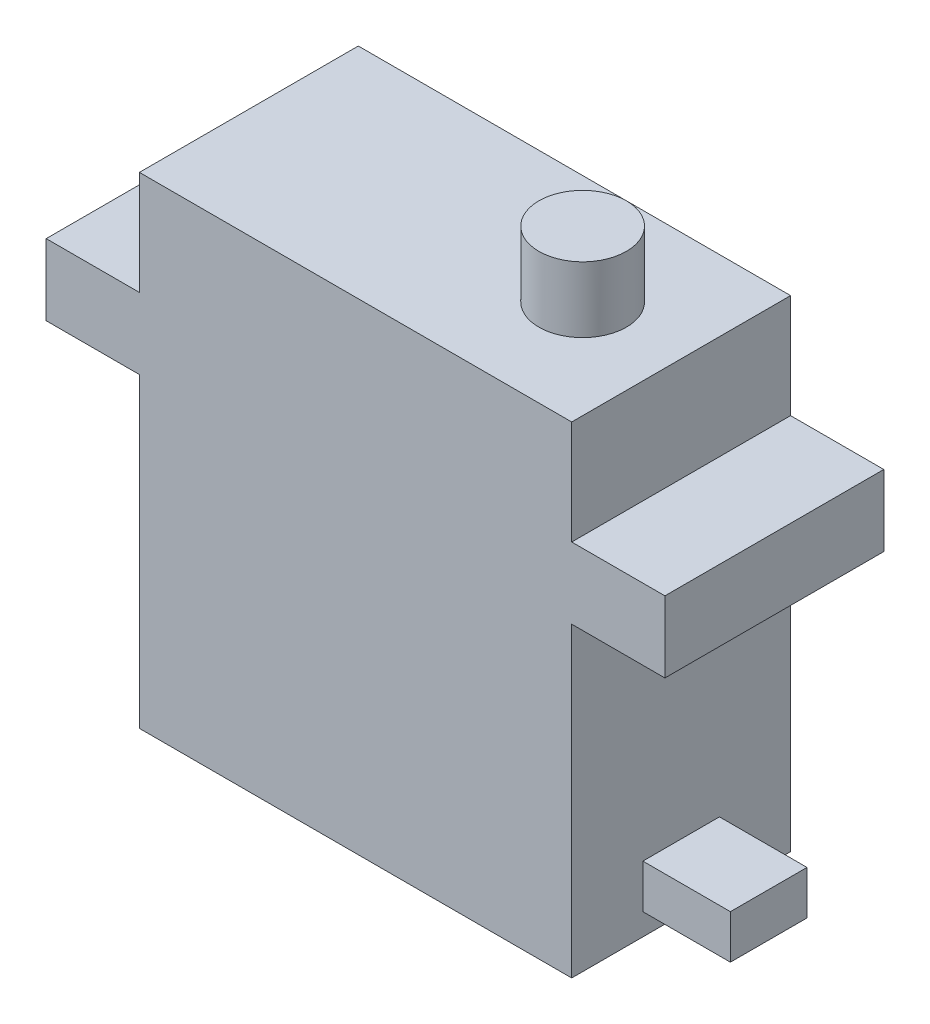
from build123d import *

# Parameters (mm, degrees)
SKETCH1_W           = 39.5
SKETCH1_H           = 20
BOSS_EXTRUDE1_DEPTH = 28
BOSS_EXTRUDE2_DEPTH = 6.5
SKETCH3_W           = 39.5
SKETCH3_H           = 20
BOSS_EXTRUDE3_DEPTH = 9.5
SKETCH4_R           = 4
BOSS_EXTRUDE4_DEPTH = 6
SKETCH5_W           = 7
SKETCH5_H           = 4
BOSS_EXTRUDE5_DEPTH = 8


with BuildPart() as part:
    # Sketch1 → Boss-Extrude1 (new body)
    with BuildSketch(Plane(origin=(0, 0, 0), x_dir=(1, 0, 0), z_dir=(0, 1, 0))):
        with Locations((-23.401244555, 9.028670505)):
            Rectangle(SKETCH1_W, SKETCH1_H)
    extrude(amount=BOSS_EXTRUDE1_DEPTH)

    # Sketch2 → Boss-Extrude2 (add)
    with BuildSketch(Plane(origin=(0, 28, 0), x_dir=(1, 0, 0), z_dir=(0, 1, 0))):
        Polygon((-43.151244555, 19.028670505), (-51.668180021, 19.028670505), (-51.668180021, -0.971329495), (-43.151244555, -0.971329495), (-3.651244555, -0.971329495), (4.86569091, -0.971329495), (4.86569091, 19.028670505), (-3.651244555, 19.028670505), align=None)
    extrude(amount=BOSS_EXTRUDE2_DEPTH)

    # Sketch3 → Boss-Extrude3 (add)
    with BuildSketch(Plane(origin=(0, 34.5, 0), x_dir=(1, 0, 0), z_dir=(0, 1, 0))):
        with Locations((-23.401244555, 9.028670505)):
            Rectangle(SKETCH3_W, SKETCH3_H)
    extrude(amount=BOSS_EXTRUDE3_DEPTH)

    # Sketch4 → Boss-Extrude4 (add)
    with BuildSketch(Plane(origin=(0, 44, 0), x_dir=(1, 0, 0), z_dir=(0, 1, 0))):
        with Locations(Location((-12.651244555, 9.028670505, 0), (0, 0, 90))):
            Circle(SKETCH4_R)
    extrude(amount=BOSS_EXTRUDE4_DEPTH)

    # Sketch5 → Boss-Extrude5 (add)
    with BuildSketch(Plane(origin=(-3.651244555, 0, 0), x_dir=(0, 0, -1), z_dir=(1, 0, 0))):
        with Locations((9.028670505, 4)):
            Rectangle(SKETCH5_W, SKETCH5_H)
    extrude(amount=BOSS_EXTRUDE5_DEPTH)


solid = part.part
